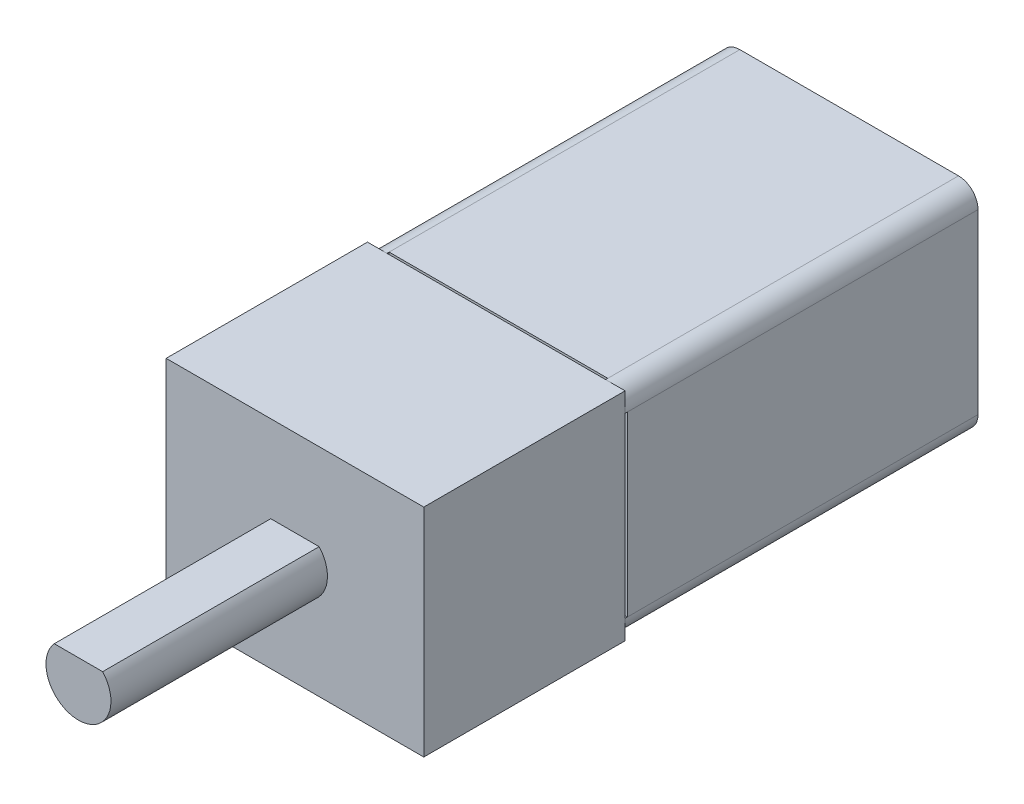
from build123d import *

# Parameters (mm, degrees)
CROQUIS1_W              = 11.9
CROQUIS1_H              = 9.3
SALIENTE_EXTRUIR1_DEPTH = 10
SALIENTE_EXTRUIR2_DEPTH = 10
SALIENTE_EXTRUIR3_DEPTH = 16.3
CROQUIS6_W              = 10.1
CROQUIS6_H              = 0.1
CORTAR_EXTRUIR1_DEPTH   = 0.1
CROQUIS7_W              = 0.1
CROQUIS7_H              = 8.2
CORTAR_EXTRUIR2_DEPTH   = 0.1
CROQUIS8_W              = 0.1
CROQUIS8_H              = 8.2
CORTAR_EXTRUIR3_DEPTH   = 0.1
CROQUIS9_W              = 10.1
CROQUIS9_H              = 0.1
CORTAR_EXTRUIR4_DEPTH   = 0.1


with BuildPart() as part:
    # Croquis1 → Saliente-Extruir1 (new body)
    with BuildSketch(Plane(origin=(0, 0, 0), x_dir=(1, 0, 0), z_dir=(0, 1, 0))):
        with Locations((5.95, 4.65)):
            Rectangle(CROQUIS1_W, CROQUIS1_H)
    extrude(amount=SALIENTE_EXTRUIR1_DEPTH)

    # Croquis2 → Saliente-Extruir2 (add)
    with BuildSketch(Plane.XY):
        with BuildLine():
            Line((4.831966011, 6), (7.068033989, 6))
            ThreePointArc((7.068033989, 6), (5.95, 3.5), (4.831966011, 6))
        make_face()
    extrude(amount=SALIENTE_EXTRUIR2_DEPTH)

    # Croquis3 → Saliente-Extruir3 (add)
    with BuildSketch(Plane(origin=(0, 0, -9.3), x_dir=(-1, 0, 0), z_dir=(0, 0, -1))):
        with BuildLine():
            Line((-11, 10), (-0.9, 10))
            ThreePointArc((-0.9, 10), (-0.263603897, 9.736396103), (0, 9.1))
            Line((0, 9.1), (0, 0.9))
            ThreePointArc((0, 0.9), (-0.263603897, 0.263603897), (-0.9, 0))
            Line((-0.9, 0), (-11, 0))
            ThreePointArc((-11, 0), (-11.636396103, 0.263603897), (-11.9, 0.9))
            Line((-11.9, 0.9), (-11.9, 9.1))
            ThreePointArc((-11.9, 9.1), (-11.636396103, 9.736396103), (-11, 10))
        make_face()
    extrude(amount=SALIENTE_EXTRUIR3_DEPTH)

    # Croquis6 → Cortar-Extruir1 (cut)
    with BuildSketch(Plane(origin=(0, 10, 0), x_dir=(1, 0, 0), z_dir=(0, 1, 0))):
        with Locations((5.95, 9.35)):
            Rectangle(CROQUIS6_W, CROQUIS6_H)
    extrude(amount=-CORTAR_EXTRUIR1_DEPTH, mode=Mode.SUBTRACT)

    # Croquis7 → Cortar-Extruir2 (cut)
    with BuildSketch(Plane(origin=(11.9, 0, 0), x_dir=(0, 0, -1), z_dir=(1, 0, 0))):
        with Locations((9.35, 5)):
            Rectangle(CROQUIS7_W, CROQUIS7_H)
    extrude(amount=-CORTAR_EXTRUIR2_DEPTH, mode=Mode.SUBTRACT)

    # Croquis8 → Cortar-Extruir3 (cut)
    with BuildSketch(Plane.ZY):
        with Locations((-9.35, 5)):
            Rectangle(CROQUIS8_W, CROQUIS8_H)
    extrude(amount=-CORTAR_EXTRUIR3_DEPTH, mode=Mode.SUBTRACT)

    # Croquis9 → Cortar-Extruir4 (cut)
    with BuildSketch(Plane.XZ):
        with Locations((5.95, -9.35)):
            Rectangle(CROQUIS9_W, CROQUIS9_H)
    extrude(amount=-CORTAR_EXTRUIR4_DEPTH, mode=Mode.SUBTRACT)


solid = part.part
